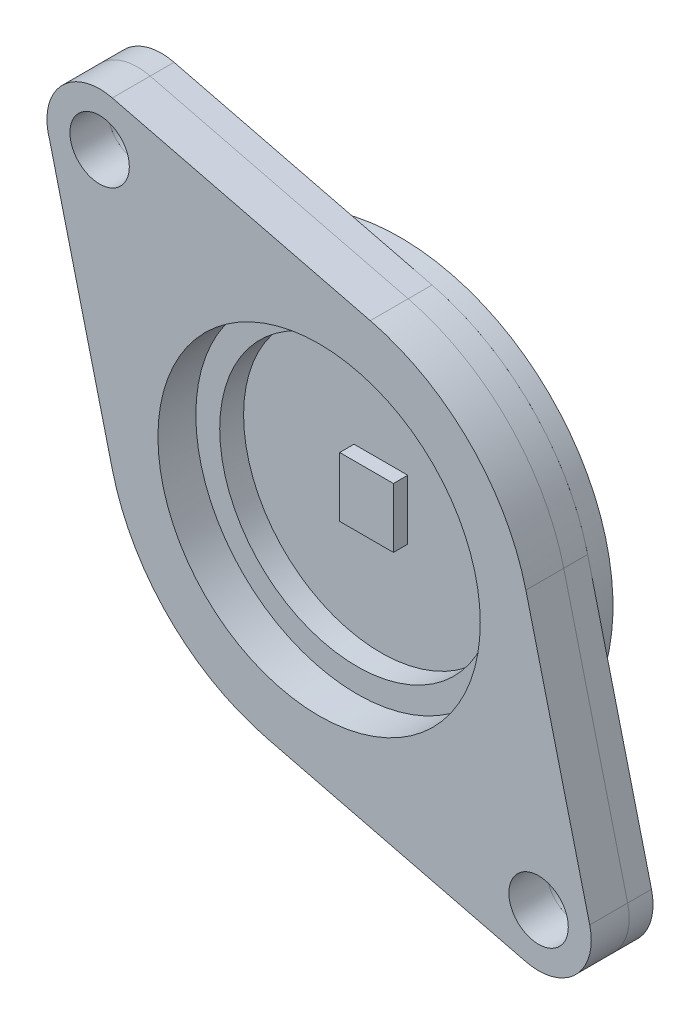
from build123d import *

# Parameters (mm, degrees)
SKETCH1_R              = 13.5
BOSS_EXTRUDE1_DEPTH    = 3.175
F_10_CLEARANCE_HOLE1_D = 4.9784
SKETCH6_R              = 11.5
SKETCH6_R_2            = 2.4892
BOSS_EXTRUDE4_DEPTH    = 2
BOSS_EXTRUDE2_DEPTH    = 1.6
SKETCH5_W              = 4.5
SKETCH5_H              = 5
BOSS_EXTRUDE3_DEPTH    = 1.2


with BuildPart() as part:
    # Sketch1 → Boss-Extrude1 (new body)
    with BuildSketch(Plane.XY):
        with BuildLine():
            Line((-22.5732405, 16.995050894), (-17.322240947, -4.276159151))
            ThreePointArc((-17.322240947, -4.276159151), (-12.620205553, -12.612532668), (-4.286693209, -17.319637116))
            Line((-4.286693209, -17.319637116), (17.324529619, -22.668518361))
            ThreePointArc((17.324529619, -22.668518361), (21.505238536, -21.505238536), (22.668518361, -17.324529619))
            Line((22.668518361, -17.324529619), (17.319637116, 4.286693209))
            ThreePointArc((17.319637116, 4.286693209), (12.616369694, 12.616369694), (4.286693209, 17.319637116))
            Line((4.286693209, 17.319637116), (-17.324529619, 22.668518361))
            ThreePointArc((-17.324529619, 22.668518361), (-21.624142677, 21.381620409), (-22.5732405, 16.995050894))
        make_face()
        Circle(SKETCH1_R, mode=Mode.SUBTRACT)
    extrude(amount=BOSS_EXTRUDE1_DEPTH)

    # #10 Clearance Hole1 (through all)
    with Locations(Plane.XY.offset(3.175)):
        with Locations((-18.384776311, 18.384776311), (18.384776311, -18.384776311)):
            Hole(F_10_CLEARANCE_HOLE1_D / 2)


with BuildPart() as body_2:
    # Sketch6 → Boss-Extrude4 (new body)
    with BuildSketch(Plane(origin=(0, 0, 0), x_dir=(-1, 0, 0), z_dir=(0, 0, -1))):
        with BuildLine():
            Line((17.324529619, 22.668518361), (-4.286693209, 17.319637116))
            ThreePointArc((-4.286693209, 17.319637116), (-12.616369694, 12.616369694), (-17.319637116, 4.286693209))
            Line((-17.319637116, 4.286693209), (-22.668518361, -17.324529619))
            ThreePointArc((-22.668518361, -17.324529619), (-21.505238536, -21.505238536), (-17.324529619, -22.668518361))
            Line((-17.324529619, -22.668518361), (4.286693209, -17.319637116))
            ThreePointArc((4.286693209, -17.319637116), (12.620205553, -12.612532668), (17.322240947, -4.276159151))
            Line((17.322240947, -4.276159151), (22.5732405, 16.995050894))
            ThreePointArc((22.5732405, 16.995050894), (21.624142677, 21.381620409), (17.324529619, 22.668518361))
        make_face()
        Circle(SKETCH6_R, mode=Mode.SUBTRACT)
        with Locations((-18.384776311, -18.384776311)):
            Circle(SKETCH6_R_2, mode=Mode.SUBTRACT)
        with Locations((18.384776311, 18.384776311)):
            Circle(SKETCH6_R_2, mode=Mode.SUBTRACT)
    extrude(amount=BOSS_EXTRUDE4_DEPTH)


with BuildPart() as body_3:
    # Sketch4 → Boss-Extrude2 (new body)
    with BuildSketch(Plane(origin=(0, 0, -2), x_dir=(-1, 0, 0), z_dir=(0, 0, -1))):
        with BuildLine():
            ThreePointArc((17.322240947, -4.276159151), (-12.620205553, 12.612532668), (4.286693209, -17.319637116))
            ThreePointArc((4.286693209, -17.319637116), (12.620205553, -12.612532668), (17.322240947, -4.276159151))
        make_face()
    extrude(amount=BOSS_EXTRUDE2_DEPTH)


with BuildPart() as body_4:
    # Sketch5 → Boss-Extrude3 (new body)
    with BuildSketch(Plane.XY.offset(-2)):
        Rectangle(SKETCH5_W, SKETCH5_H)
    extrude(amount=BOSS_EXTRUDE3_DEPTH)


solid = Compound([part.part, body_2.part, body_3.part, body_4.part])
